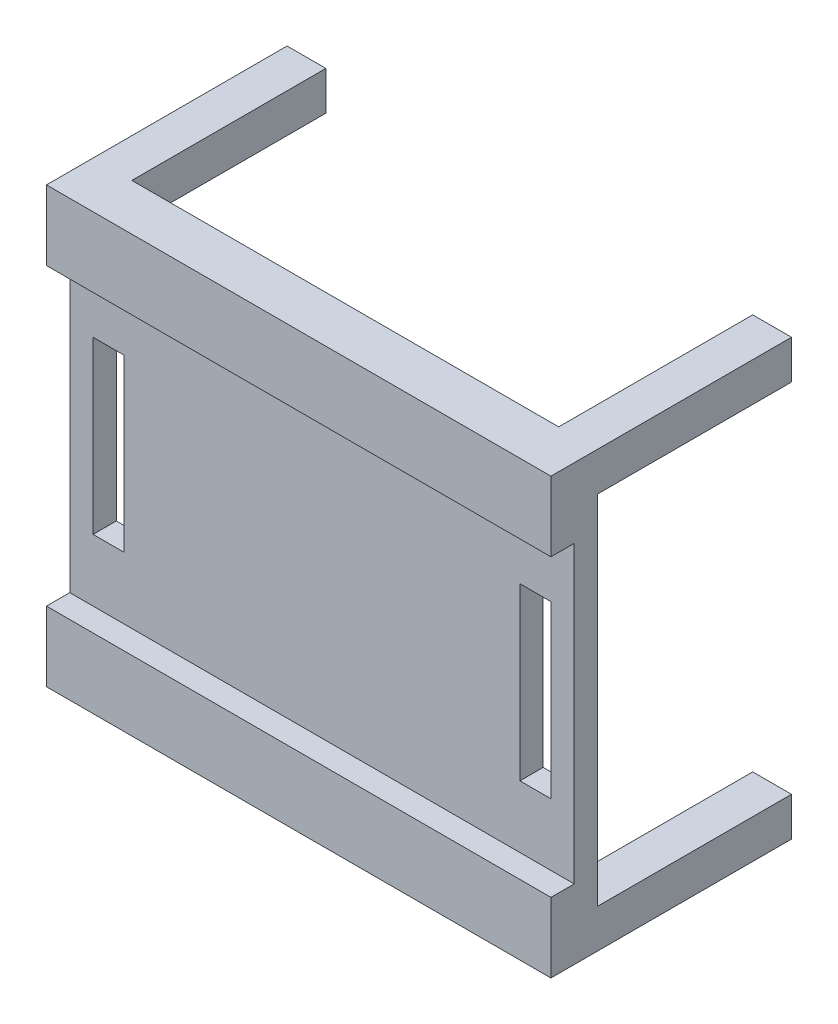
from build123d import *

# Parameters (mm, degrees)
ESQUISSE1_W                                = 65
ESQUISSE1_H                                = 56
BOSS_EXTRU_1_DEPTH                         = 6
ESQUISSE4_W                                = 65
ESQUISSE4_H                                = 38
ENL_V_MAT_EXTRU_1_DEPTH                    = 3
ESQUISSE5_W                                = 5
ESQUISSE5_H                                = 5
BOSS_EXTRU_2_DEPTH                         = 25
ESQUISSE6_R                                = 1.1
ENL_V_MAT_EXTRU_2_DEPTH                    = 3
ESQUISSE7_W                                = 4
ESQUISSE7_H                                = 22
ENL_V_MAT_EXTRU_3_DEPTH                    = 50.651283971
SYM_TRIE1_AT_THE_SECOND_PLANE_COPY_1_SKE_W = 5
SYM_TRIE1_AT_THE_SECOND_PLANE_COPY_1_SKE_H = 5
SYM_TRIE1_AT_THE_SECOND_PLANE_COPY_1_DEPTH = 25
SYM_TRIE1_AT_THE_SECOND_PLANE_COPY_2_SKE_R = 1.1
SYM_TRIE1_AT_THE_SECOND_PLANE_COPY_2_DEPTH = 3


with BuildPart() as part:
    # Esquisse1 → Boss.-Extru.1 (new body)
    with BuildSketch(Plane.XY):
        Rectangle(ESQUISSE1_W, ESQUISSE1_H)
    extrude(amount=BOSS_EXTRU_1_DEPTH)

    # Esquisse4 → Enlèv. mat.-Extru.1 (cut)
    with BuildSketch(Plane.XY.offset(6)):
        Rectangle(ESQUISSE4_W, ESQUISSE4_H)
    extrude(amount=-ENL_V_MAT_EXTRU_1_DEPTH, mode=Mode.SUBTRACT)

    # Esquisse5 → Boss.-Extru.2 (add)
    with BuildSketch(Plane(origin=(0, 0, 0), x_dir=(-1, 0, 0), z_dir=(0, 0, -1))):
        with Locations((-30, 25.5)):
            Rectangle(ESQUISSE5_W, ESQUISSE5_H)
    boss_extru_2 = extrude(amount=BOSS_EXTRU_2_DEPTH)

    # Esquisse6 → Enlèv. mat.-Extru.2 (cut)
    with BuildSketch(Plane(origin=(0, 0, -25), x_dir=(-1, 0, 0), z_dir=(0, 0, -1))):
        with Locations((-29, 24.5)):
            Circle(ESQUISSE6_R)
    enl_v_mat_extru_2 = extrude(amount=-ENL_V_MAT_EXTRU_2_DEPTH, mode=Mode.SUBTRACT)

    # Esquisse7 → Enlèv. mat.-Extru.3 (cut, through all)
    with BuildSketch(Plane(origin=(0, 0, 0), x_dir=(-1, 0, 0), z_dir=(0, 0, -1))):
        with Locations((-27.5, 0)):
            Rectangle(ESQUISSE7_W, ESQUISSE7_H)
        with Locations((27.5, 0)):
            Rectangle(ESQUISSE7_W, ESQUISSE7_H)
    extrude(amount=-ENL_V_MAT_EXTRU_3_DEPTH, mode=Mode.SUBTRACT)

    # Symétrie1: Boss.-Extru.2, Enlèv. mat.-Extru.2 across plane
    add(boss_extru_2.mirror(Plane.ZX))
    add(enl_v_mat_extru_2.mirror(Plane.ZX), mode=Mode.SUBTRACT)

    # Symétrie1 at the second plane: Boss.-Extru.2, Enlèv. mat.-Extru.2 across plane
    add(boss_extru_2.mirror(Plane(origin=(0, 0, 0), x_dir=(0, 0, 1), z_dir=(1, 0, 0))))
    add(enl_v_mat_extru_2.mirror(Plane(origin=(0, 0, 0), x_dir=(0, 0, 1), z_dir=(1, 0, 0))), mode=Mode.SUBTRACT)

    # Symétrie1 at the second plane copy 1 ske → Symétrie1 at the second plane copy 1 (add)
    with BuildSketch(Plane(origin=(0, 0, 0), x_dir=(1, 0, 0), z_dir=(0, 0, -1))):
        with Locations((-30, 25.5)):
            Rectangle(SYM_TRIE1_AT_THE_SECOND_PLANE_COPY_1_SKE_W, SYM_TRIE1_AT_THE_SECOND_PLANE_COPY_1_SKE_H)
    extrude(amount=SYM_TRIE1_AT_THE_SECOND_PLANE_COPY_1_DEPTH)

    # Symétrie1 at the second plane copy 2 ske → Symétrie1 at the second plane copy 2 (cut)
    with BuildSketch(Plane(origin=(0, 0, -25), x_dir=(1, 0, 0), z_dir=(0, 0, -1))):
        with Locations((-29, 24.5)):
            Circle(SYM_TRIE1_AT_THE_SECOND_PLANE_COPY_2_SKE_R)
    extrude(amount=-SYM_TRIE1_AT_THE_SECOND_PLANE_COPY_2_DEPTH, mode=Mode.SUBTRACT)


solid = part.part
